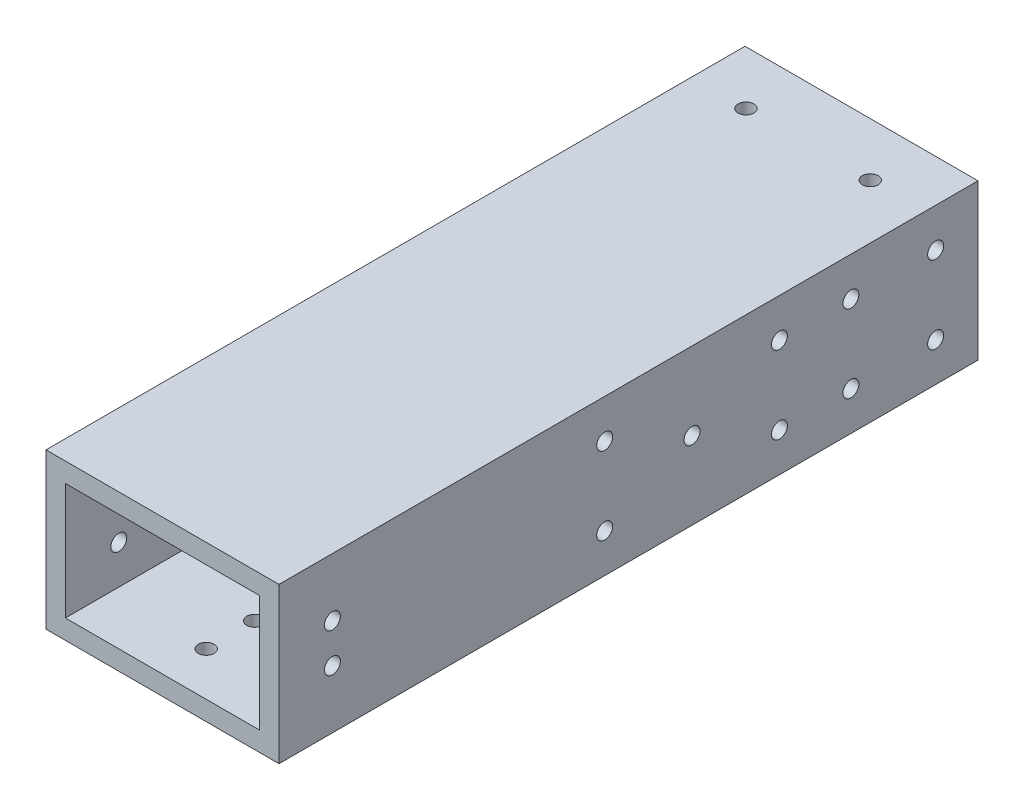
from build123d import *

# Parameters (mm, degrees)
BOSS_EXTRUDE1_DEPTH      = 152.4
BOSS_EXTRUDE1_DEPTH_BACK = 76.2
SKETCH1_W                = 76.2
SKETCH1_H                = 50.8
SKETCH1_W_2              = 63.5
SKETCH1_H_2              = 38.1
CUT_EXTRUDE1_DEPTH       = 804.658803572
CUT_EXTRUDE1_DEPTH_BACK  = 804.658803572
SKETCH2_R                = 2.6035
SKETCH2_R_2              = 2.603499999
SKETCH3_R                = 2.6035
CUT_EXTRUDE2_DEPTH       = 807.363629238
SKETCH4_R                = 2.6035
CUT_EXTRUDE3_DEPTH       = 166.1
CUT_EXTRUDE4_REACH       = 167.1
SKETCH5_R                = 2.6035


with BuildPart() as part:
    # Sketch1 → Boss-Extrude1 (new, two sides: drawn at the far end of the back side and taken through both)
    with BuildSketch(Plane.XY.offset(-BOSS_EXTRUDE1_DEPTH_BACK)):
        with Locations((0, 762.756140976)):
            Rectangle(SKETCH1_W, SKETCH1_H)
        with Locations((0, 762.756140976)):
            Rectangle(SKETCH1_W_2, SKETCH1_H_2, mode=Mode.SUBTRACT)
    extrude(amount=BOSS_EXTRUDE1_DEPTH + BOSS_EXTRUDE1_DEPTH_BACK)

    # Sketch2 → Cut-Extrude1 (cut, two sides: drawn at the far end of the back side and taken through both)
    with BuildSketch(Plane(origin=(0, 0, 0), x_dir=(0, 0, -1), z_dir=(1, 0, 0)).offset(-CUT_EXTRUDE1_DEPTH_BACK)):
        with Locations((62.346011746, 750.056140976)):
            Circle(SKETCH2_R)
        with Locations(Location((34.638035237, 750.056140976, 0), (0, 0, 90))):
            Circle(SKETCH2_R)
        with Locations((34.638035237, 775.456140976)):
            Circle(SKETCH2_R)
        with Locations(Location((62.346011746, 775.456140976, 0), (0, 0, 90))):
            Circle(SKETCH2_R)
        with Locations((11.259046982, 750.056140976)):
            Circle(SKETCH2_R_2)
        with Locations((11.259046982, 775.456140976)):
            Circle(SKETCH2_R_2)
        with Locations((-17.315953018, 762.756140976)):
            Circle(SKETCH2_R_2)
        with Locations((-45.890953018, 775.456140976)):
            Circle(SKETCH2_R_2)
        with Locations((-45.890953018, 750.056140976)):
            Circle(SKETCH2_R_2)
    extrude(amount=CUT_EXTRUDE1_DEPTH + CUT_EXTRUDE1_DEPTH_BACK, mode=Mode.SUBTRACT)

    # Sketch3 → Cut-Extrude2 (cut, through all)
    with BuildSketch(Plane(origin=(38.1, 0, 0), x_dir=(0, 0, -1), z_dir=(1, 0, 0))):
        with Locations((-134.9375, 769.106140976)):
            Circle(SKETCH3_R)
        with Locations((-134.9375, 756.406140976)):
            Circle(SKETCH3_R)
    extrude(amount=-CUT_EXTRUDE2_DEPTH, mode=Mode.SUBTRACT)

    # Sketch4 → Cut-Extrude3 (cut, through all)
    with BuildSketch(Plane(origin=(0, 788.156140976, 0), x_dir=(1, 0, 0), z_dir=(0, 1, 0))):
        with Locations(Location((20.32, 58.7375, 0), (0, 0, 270))):
            Circle(SKETCH4_R)
        with Locations(Location((-20.32, 58.7375, 0), (0, 0, 270))):
            Circle(SKETCH4_R)
    extrude(amount=-CUT_EXTRUDE3_DEPTH, mode=Mode.SUBTRACT)

    # Sketch5 → Cut-Extrude4 (cut, up to next)
    with BuildSketch(Plane.XZ.offset(-737.356140976), mode=Mode.PRIVATE) as cut_extrude4_sk1:
        with Locations(Location((0, 138.1125, 0), (0, 0, 270))):
            Circle(SKETCH5_R)
    cut_extrude4_tool1 = extrude(cut_extrude4_sk1.sketch, amount=-CUT_EXTRUDE4_REACH, mode=Mode.PRIVATE) & part.part
    # Sketch5 → Cut-Extrude4 (cut, up to next)
    with BuildSketch(Plane.XZ.offset(-737.356140976), mode=Mode.PRIVATE) as cut_extrude4_sk2:
        with Locations(Location((0, 122.2375, 0), (0, 0, 270))):
            Circle(SKETCH5_R)
    cut_extrude4_tool2 = extrude(cut_extrude4_sk2.sketch, amount=-CUT_EXTRUDE4_REACH, mode=Mode.PRIVATE) & part.part
    add(cut_extrude4_tool1.solids().sort_by_distance((0, 737.356141, 138.1125))[0], mode=Mode.SUBTRACT)
    add(cut_extrude4_tool2.solids().sort_by_distance((0, 737.356141, 122.2375))[0], mode=Mode.SUBTRACT)


solid = part.part
